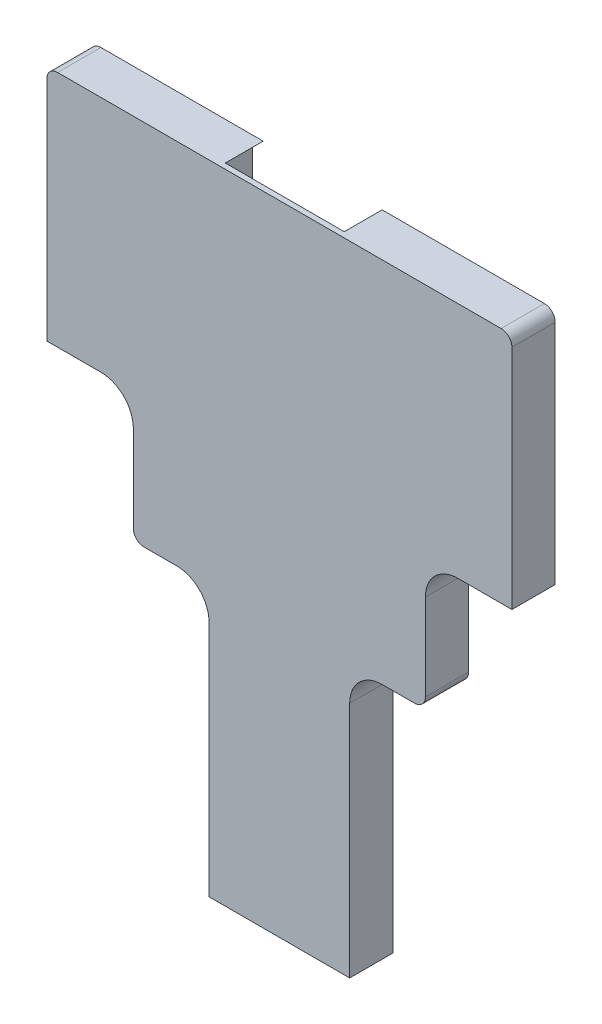
from build123d import *

# Parameters (mm, degrees)
CUT_EXTRUDE1_DEPTH = 3.5


with BuildPart() as part:
    # Sweep1: sweep along a path in Sketch3
    with BuildLine(Plane(origin=(0, 0, 0), x_dir=(0, 0, -1), z_dir=(1, 0, 0))) as sweep1_path:
        Line((0, 0), (4, 0))
    # Sketch4 → Sweep1 (sweep)
    with BuildSketch(Plane(origin=(0, 0, -4), x_dir=(-1, 0, 0), z_dir=(0, 0, -1))):
        with BuildLine():
            Line((-6.5, 0), (6.5, 0))
            Line((6.5, 0), (6.5, 22))
            ThreePointArc((6.5, 22), (7.378679656, 24.121320344), (9.5, 25))
            Line((9.5, 25), (12.5, 25))
            ThreePointArc((12.5, 25), (13.207106781, 25.292893219), (13.5, 26))
            Line((13.5, 26), (13.5, 34))
            ThreePointArc((13.5, 34), (14.378679656, 36.121320344), (16.5, 37))
            Line((16.5, 37), (21.5, 37))
            Line((21.5, 37), (21.5, 58))
            ThreePointArc((21.5, 58), (21.207106781, 58.707106781), (20.5, 59))
            Line((20.5, 59), (-20.5, 59))
            ThreePointArc((-20.5, 59), (-21.207106781, 58.707106781), (-21.5, 58))
            Line((-21.5, 58), (-21.5, 37))
            Line((-21.5, 37), (-16.5, 37))
            ThreePointArc((-16.5, 37), (-14.378679656, 36.121320344), (-13.5, 34))
            Line((-13.5, 34), (-13.5, 26))
            ThreePointArc((-13.5, 26), (-13.207106781, 25.292893219), (-12.5, 25))
            Line((-12.5, 25), (-9.5, 25))
            ThreePointArc((-9.5, 25), (-7.378679656, 24.121320344), (-6.5, 22))
            Line((-6.5, 22), (-6.5, 0))
        make_face()
    sweep(path=sweep1_path.line)

    # Sketch5 → Cut-Extrude1 (cut)
    with BuildSketch(Plane(origin=(0, 0, -4), x_dir=(-1, 0, 0), z_dir=(0, 0, -1))):
        with BuildLine():
            Line((-1, 0), (1, 0))
            ThreePointArc((1, 0), (1.353553391, 0.146446609), (1.5, 0.5))
            Line((1.5, 0.5), (1.5, 20))
            Line((1.5, 20), (2.5, 20))
            ThreePointArc((2.5, 20), (3.207106781, 20.292893219), (3.5, 21))
            Line((3.5, 21), (3.5, 26))
            ThreePointArc((3.5, 26), (3.792893219, 26.707106781), (4.5, 27))
            Line((4.5, 27), (5.5, 27))
            ThreePointArc((5.5, 27), (6.207106781, 27.292893219), (6.5, 28))
            Line((6.5, 28), (6.5, 58))
            ThreePointArc((6.5, 58), (6.207106781, 58.707106781), (5.5, 59))
            Line((5.5, 59), (-5.5, 59))
            ThreePointArc((-5.5, 59), (-6.207106781, 58.707106781), (-6.5, 58))
            Line((-6.5, 58), (-6.5, 28))
            ThreePointArc((-6.5, 28), (-6.207106781, 27.292893219), (-5.5, 27))
            Line((-5.5, 27), (-4.5, 27))
            ThreePointArc((-4.5, 27), (-3.792893219, 26.707106781), (-3.5, 26))
            Line((-3.5, 26), (-3.5, 21))
            ThreePointArc((-3.5, 21), (-3.207106781, 20.292893219), (-2.5, 20))
            Line((-2.5, 20), (-1.5, 20))
            Line((-1.5, 20), (-1.5, 0.5))
            ThreePointArc((-1.5, 0.5), (-1.353553391, 0.146446609), (-1, 0))
        make_face()
    extrude(amount=-CUT_EXTRUDE1_DEPTH, mode=Mode.SUBTRACT)


solid = part.part
